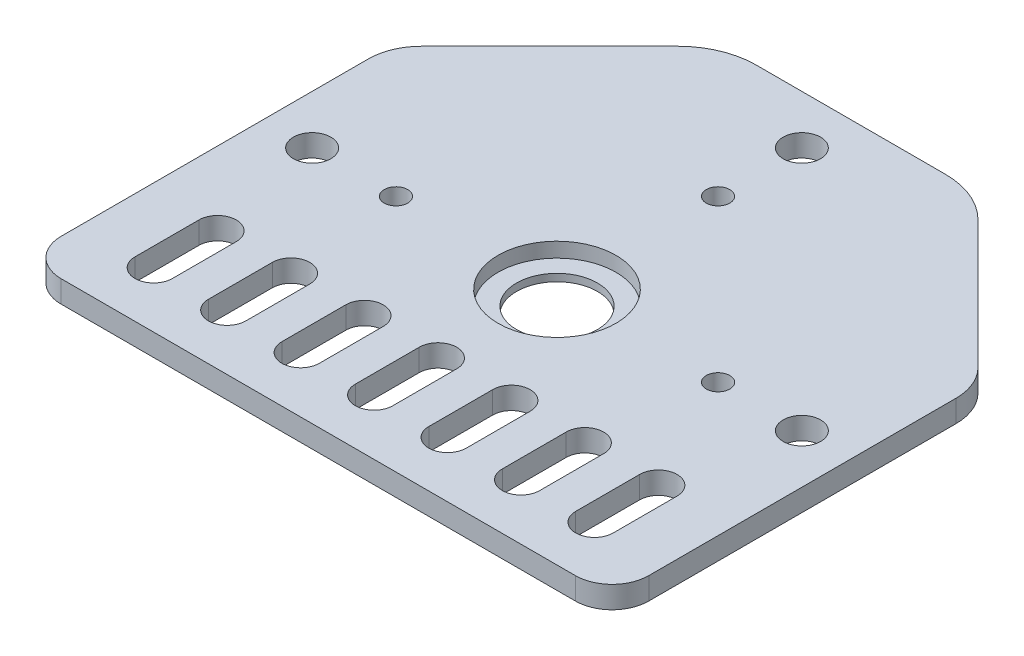
from build123d import *

# Parameters (mm, degrees)
SKETCH1_R           = 1.6
SKETCH1_R_2         = 5.5
SKETCH1_R_3         = 2.55
BOSS_EXTRUDE1_DEPTH = 3
SKETCH2_R           = 8.025
CUT_EXTRUDE1_DEPTH  = 2


with BuildPart() as part:
    # Sketch1 → Boss-Extrude1 (new body)
    with BuildSketch(Plane(origin=(0, 0, 0), x_dir=(1, 0, 0), z_dir=(0, 1, 0))):
        with BuildLine():
            Line((35, -32.5), (-35, -32.5))
            ThreePointArc((-35, -32.5), (-38.535533906, -31.035533906), (-40, -27.5))
            Line((-40, -27.5), (-40, 14.306951673))
            ThreePointArc((-40, 14.306951673), (-39.448126611, 17.081406557), (-37.876524164, 19.433475836))
            Line((-37.876524164, 19.433475836), (-20.438099577, 36.871900423))
            ThreePointArc((-20.438099577, 36.871900423), (-16.973258212, 39.187033407), (-12.886199154, 40))
            Line((-12.886199154, 40), (12.886199154, 40))
            ThreePointArc((12.886199154, 40), (16.973258212, 39.187033407), (20.438099577, 36.871900423))
            Line((20.438099577, 36.871900423), (37.876524164, 19.433475836))
            ThreePointArc((37.876524164, 19.433475836), (39.448126611, 17.081406557), (40, 14.306951673))
            Line((40, 14.306951673), (40, -27.5))
            ThreePointArc((40, -27.5), (38.535533906, -31.035533906), (35, -32.5))
        make_face()
        with Locations(Location((21.920310217, 0, 0), (0, 0, 270))):
            Circle(SKETCH1_R, mode=Mode.SUBTRACT)
        with Locations(Location((-21.920310217, 0, 0), (0, 0, 90))):
            Circle(SKETCH1_R, mode=Mode.SUBTRACT)
        with Locations(Location((0, 0, 0), (0, 0, 270))):
            Circle(SKETCH1_R_2, mode=Mode.SUBTRACT)
        with Locations(Location((0, 21.920310217, 0), (0, 0, 270))):
            Circle(SKETCH1_R, mode=Mode.SUBTRACT)
        with Locations(Location((-33.333013665, 0, 0), (0, 0, 270))):
            Circle(SKETCH1_R_3, mode=Mode.SUBTRACT)
        with Locations(Location((0, 33.333013665, 0), (0, 0, 270))):
            Circle(SKETCH1_R_3, mode=Mode.SUBTRACT)
        with Locations(Location((33.333013665, 0, 0), (0, 0, 90))):
            Circle(SKETCH1_R_3, mode=Mode.SUBTRACT)
        with BuildLine():
            Line((27.45, -24.9), (27.45, -16.2))
            ThreePointArc((27.45, -16.2), (30, -13.65), (32.55, -16.2))
            Line((32.55, -16.2), (32.55, -24.9))
            ThreePointArc((32.55, -24.9), (30, -27.45), (27.45, -24.9))
        make_face(mode=Mode.SUBTRACT)
        with BuildLine():
            Line((17.45, -24.9), (17.45, -16.2))
            ThreePointArc((17.45, -16.2), (20, -13.65), (22.55, -16.2))
            Line((22.55, -16.2), (22.55, -24.9))
            ThreePointArc((22.55, -24.9), (20, -27.45), (17.45, -24.9))
        make_face(mode=Mode.SUBTRACT)
        with BuildLine():
            Line((7.45, -24.9), (7.45, -16.2))
            ThreePointArc((7.45, -16.2), (10, -13.65), (12.55, -16.2))
            Line((12.55, -16.2), (12.55, -24.9))
            ThreePointArc((12.55, -24.9), (10, -27.45), (7.45, -24.9))
        make_face(mode=Mode.SUBTRACT)
        with BuildLine():
            Line((-2.55, -24.9), (-2.55, -16.2))
            ThreePointArc((-2.55, -16.2), (0, -13.65), (2.55, -16.2))
            Line((2.55, -16.2), (2.55, -24.9))
            ThreePointArc((2.55, -24.9), (0, -27.45), (-2.55, -24.9))
        make_face(mode=Mode.SUBTRACT)
        with BuildLine():
            Line((-12.55, -24.9), (-12.55, -16.2))
            ThreePointArc((-12.55, -16.2), (-10, -13.65), (-7.45, -16.2))
            Line((-7.45, -16.2), (-7.45, -24.9))
            ThreePointArc((-7.45, -24.9), (-10, -27.45), (-12.55, -24.9))
        make_face(mode=Mode.SUBTRACT)
        with BuildLine():
            Line((-22.55, -24.9), (-22.55, -16.2))
            ThreePointArc((-22.55, -16.2), (-20, -13.65), (-17.45, -16.2))
            Line((-17.45, -16.2), (-17.45, -24.9))
            ThreePointArc((-17.45, -24.9), (-20, -27.45), (-22.55, -24.9))
        make_face(mode=Mode.SUBTRACT)
        with BuildLine():
            Line((-32.55, -24.9), (-32.55, -16.2))
            ThreePointArc((-32.55, -16.2), (-30, -13.65), (-27.45, -16.2))
            Line((-27.45, -16.2), (-27.45, -24.9))
            ThreePointArc((-27.45, -24.9), (-30, -27.45), (-32.55, -24.9))
        make_face(mode=Mode.SUBTRACT)
    extrude(amount=BOSS_EXTRUDE1_DEPTH)

    # Sketch2 → Cut-Extrude1 (cut)
    with BuildSketch(Plane(origin=(0, 3, 0), x_dir=(1, 0, 0), z_dir=(0, 1, 0))):
        with Locations(Location((0, 0, 0), (0, 0, 270))):
            Circle(SKETCH2_R)
    extrude(amount=-CUT_EXTRUDE1_DEPTH, mode=Mode.SUBTRACT)


solid = part.part
